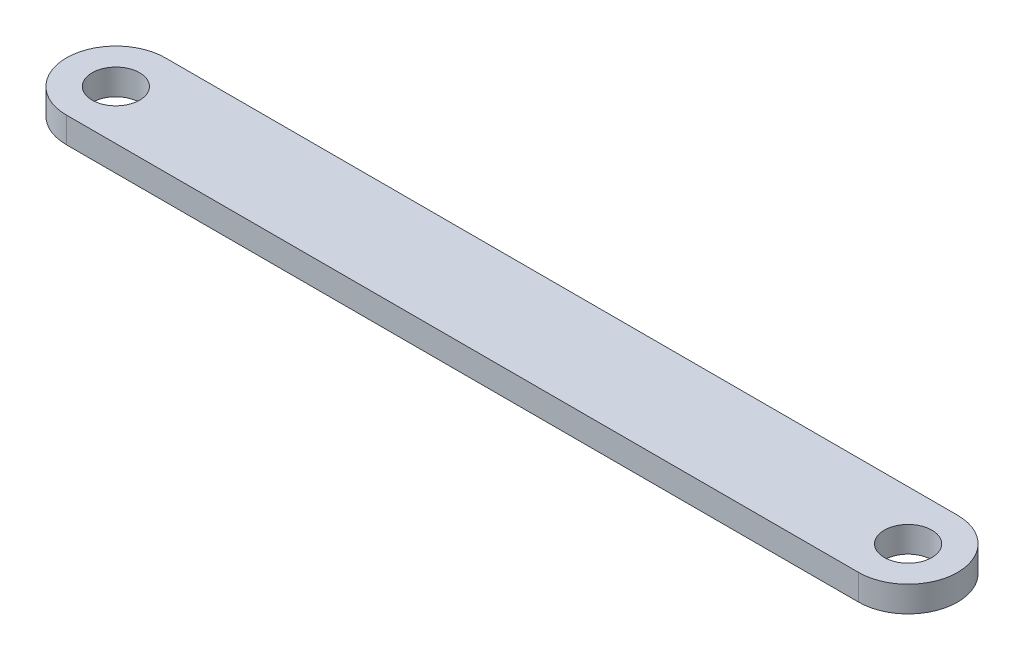
from build123d import *

# Parameters (mm, degrees)
SZKIC1_R                    = 6
DODANIE_WYCI_GNI_CIE1_DEPTH = 6.5


with BuildPart() as part:
    # Szkic1 → Dodanie-wyciągnięcie1 (new body)
    with BuildSketch(Plane(origin=(0, 0, 0), x_dir=(1, 0, 0), z_dir=(0, 1, 0))):
        with BuildLine():
            Line((0, 12.5), (200, 12.5))
            ThreePointArc((200, 12.5), (212.5, 0), (200, -12.5))
            Line((200, -12.5), (0, -12.5))
            ThreePointArc((0, -12.5), (-12.5, 0), (0, 12.5))
        make_face()
        with Locations(Location((0, 0, 0), (0, 0, 90))):
            Circle(SZKIC1_R, mode=Mode.SUBTRACT)
        with Locations(Location((200, 0, 0), (0, 0, 90))):
            Circle(SZKIC1_R, mode=Mode.SUBTRACT)
    extrude(amount=DODANIE_WYCI_GNI_CIE1_DEPTH)


solid = part.part
